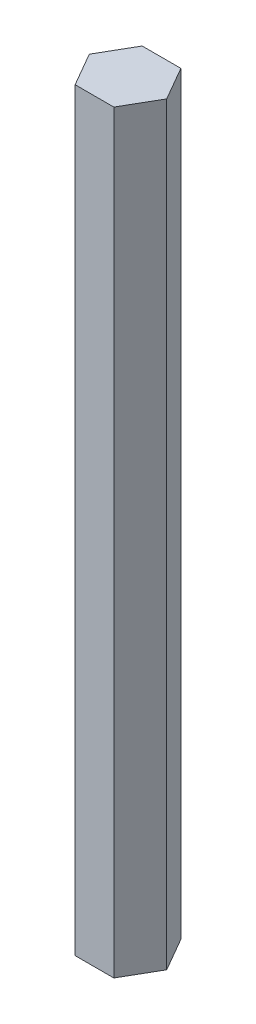
from build123d import *

# Parameters (mm, degrees)
BOSS_EXTRUDE1_DEPTH = 142.875


with BuildPart() as part:
    # Sketch1 → Boss-Extrude1 (new body)
    with BuildSketch(Plane(origin=(0, 0, 0), x_dir=(1, 0, 0), z_dir=(0, 1, 0))):
        Polygon((7.332348419, 0), (3.666174209, 6.35), (-3.666174209, 6.35), (-7.332348419, 0), (-3.666174209, -6.35), (3.666174209, -6.35), align=None)
    extrude(amount=BOSS_EXTRUDE1_DEPTH)


solid = part.part
